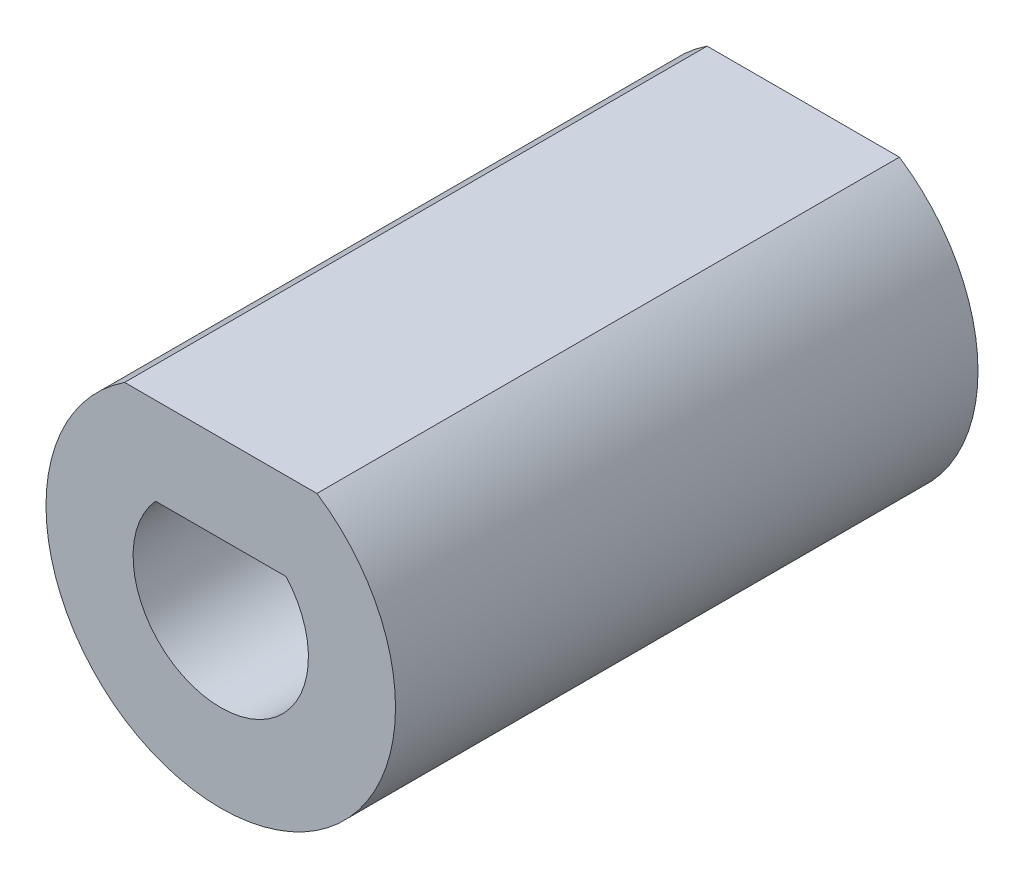
from build123d import *

# Parameters (mm, degrees)
SKETCH_1_R          = 3
EXTRUDE_1_DEPTH     = 10
CUT_EXTRUDE_1_DEPTH = 10
CUT_EXTRUDE_2_DEPTH = 10


with BuildPart() as part:
    # 草图1 → 凸台-拉伸1 (new body)
    with BuildSketch(Plane.XY):
        Circle(SKETCH_1_R)
    extrude(amount=EXTRUDE_1_DEPTH)

    # 草图2 → 切除-拉伸1 (cut)
    with BuildSketch(Plane.XY.offset(10)):
        with BuildLine():
            Line((1.120267825, 1.005), (-1.120267825, 1.005))
            ThreePointArc((-1.120267825, 1.005), (0, -1.505), (1.120267825, 1.005))
        make_face()
    extrude(amount=-CUT_EXTRUDE_1_DEPTH, mode=Mode.SUBTRACT)

    # 草图3 → 切除-拉伸2 (cut)
    with BuildSketch(Plane(origin=(0, 0, 0), x_dir=(-1, 0, 0), z_dir=(0, 0, -1))):
        with BuildLine():
            Line((-1.65074983, 2.505), (1.65074983, 2.505))
            ThreePointArc((1.65074983, 2.505), (0, 3), (-1.65074983, 2.505))
        make_face()
    extrude(amount=-CUT_EXTRUDE_2_DEPTH, mode=Mode.SUBTRACT)


solid = part.part
